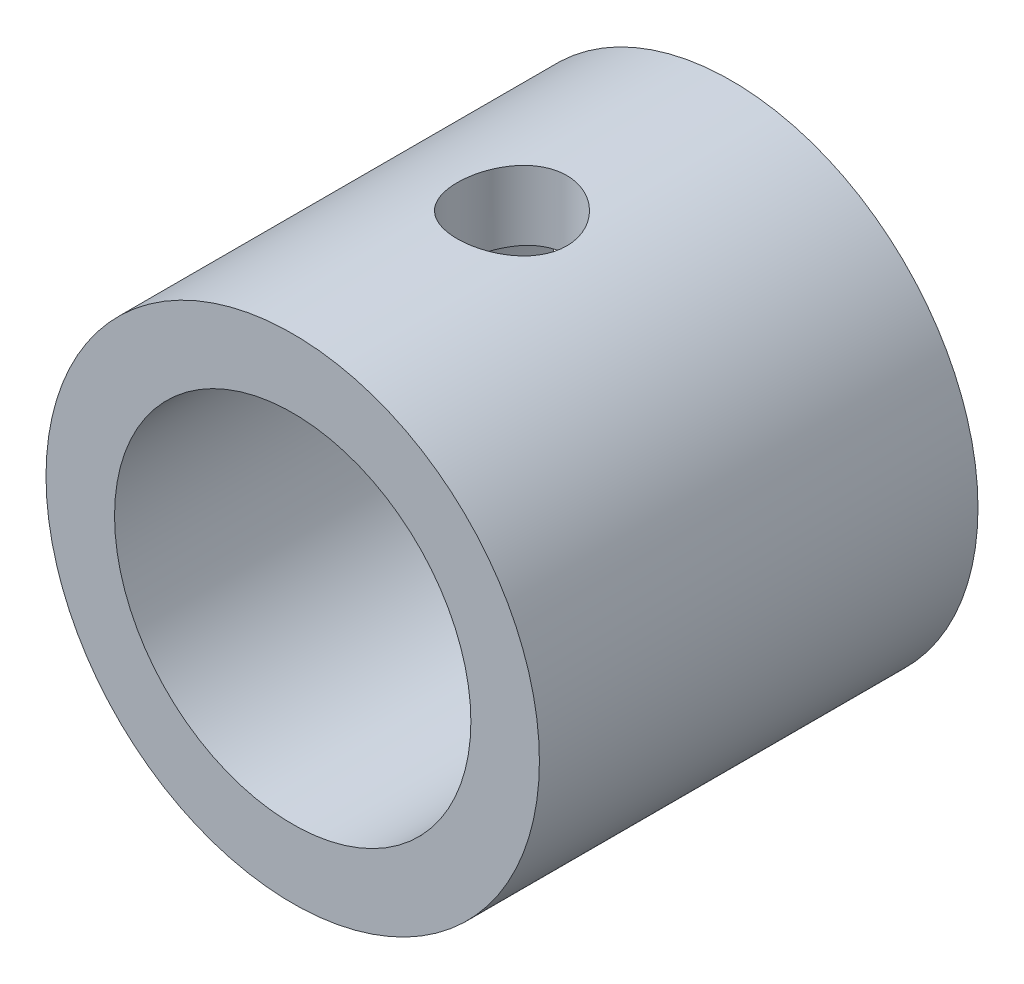
from build123d import *

# Parameters (mm, degrees)
SKETCH1_R               = 9
SKETCH1_R_2             = 6.5
BOSS_EXTRUDE1_DEPTH     = 8
CUT_EXTRUDE1_REACH      = 17.033
CUT_EXTRUDE1_END_RADIUS = 9
SKETCH2_R               = 2


with BuildPart() as part:
    # Sketch1 → Boss-Extrude1 (new, symmetric)
    with BuildSketch(Plane.XY):
        Circle(SKETCH1_R)
        Circle(SKETCH1_R_2, mode=Mode.SUBTRACT)
    extrude(amount=BOSS_EXTRUDE1_DEPTH, both=True)

    # Cut-Extrude1: up to this cylinder (the profile starts inside it)
    cut_extrude1_end = Plane(origin=(0, 0, 0), z_dir=(0, 0, -1)) * Cylinder(CUT_EXTRUDE1_END_RADIUS, 53.066, mode=Mode.PRIVATE)
    # Sketch2 → Cut-Extrude1 (cut, up to the surface)
    with BuildSketch(Plane(origin=(0, 0, 0), x_dir=(1, 0, 0), z_dir=(0, 1, 0)), mode=Mode.PRIVATE) as cut_extrude1_sk1:
        with Locations(Location((0, 0, 0), (0, 0, 90))):
            Circle(SKETCH2_R)
    cut_extrude1_tool1 = extrude(cut_extrude1_sk1.sketch, amount=CUT_EXTRUDE1_REACH, mode=Mode.PRIVATE) & cut_extrude1_end
    add(cut_extrude1_tool1.solids().sort_by_distance((0, 0, 0))[0], mode=Mode.SUBTRACT)


solid = part.part
